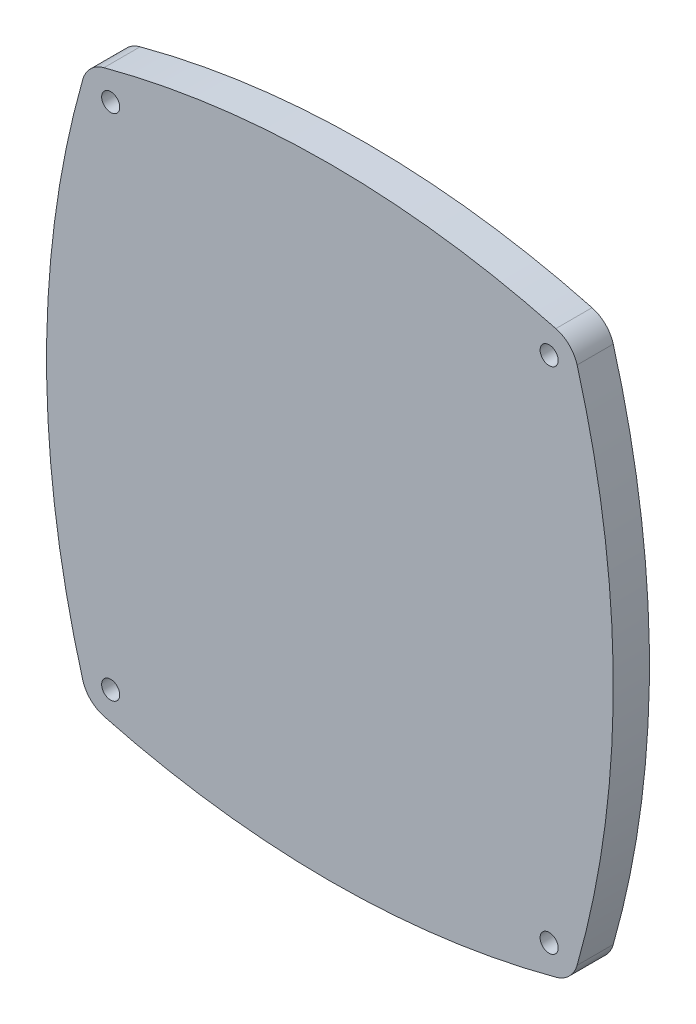
from build123d import *

# Parameters (mm, degrees)
BOSS_EXTRUDE1_DEPTH                                  = 6
CUT_EXTRUDE1_DEPTH                                   = 3
CBORE_FOR_1_4_BINDING_HEAD_MACHINE_SCREW_D           = 3.000000096
CBORE_FOR_1_4_BINDING_HEAD_MACHINE_SCREW_CBORE_D     = 5.999999938
CBORE_FOR_1_4_BINDING_HEAD_MACHINE_SCREW_CBORE_DEPTH = 2.50000008


with BuildPart() as part:
    # Sketch2 → Boss-Extrude1 (new body)
    with BuildSketch(Plane.XY):
        with BuildLine():
            ThreePointArc((-54.248199695, 36.170030774), (-60.248199695, -6.952025582), (-54.248199695, -50.074081938))
            ThreePointArc((-54.248199695, -50.074081938), (-52.94547726, -52.272598149), (-50.726555175, -53.540251118))
            ThreePointArc((-50.726555175, -53.540251118), (-13.248199695, -58.452025582), (24.230155786, -53.540251118))
            ThreePointArc((24.230155786, -53.540251118), (26.449077871, -52.272598149), (27.751800305, -50.074081938))
            ThreePointArc((27.751800305, -50.074081938), (33.751800305, -6.952025582), (27.751800305, 36.170030774))
            ThreePointArc((27.751800305, 36.170030774), (26.449077871, 38.368546985), (24.230155786, 39.636199954))
            ThreePointArc((24.230155786, 39.636199954), (-13.248199695, 44.547974418), (-50.726555175, 39.636199954))
            ThreePointArc((-50.726555175, 39.636199954), (-52.94547726, 38.368546985), (-54.248199695, 36.170030774))
        make_face()
    extrude(amount=BOSS_EXTRUDE1_DEPTH)

    # Sketch3 → Cut-Extrude1 (cut)
    # profile 1 of 3: a face of its own
    with BuildSketch(Plane(origin=(0, 0, 0), x_dir=(-1, 0, 0), z_dir=(0, 0, -1))):
        with BuildLine():
            Line((27.557264502, 1.973116974), (27.705702002, 1.973116974))
            add(Edge.make_bspline(
                [(27.705702002, 1.973116974), (27.939373877, 1.718273224), (28.188905127, 1.401241974), (28.454530127, 1.022570099)],
                knots=[16, 16, 16, 16, 17, 17, 17, 17], degree=3))
            add(Edge.make_bspline(
                [(28.454530127, 1.022570099), (28.719998877, 0.643663849), (28.964373877, 0.234874786), (29.18738169, -0.204148651)],
                knots=[17, 17, 17, 17, 18, 18, 18, 18], degree=3))
            add(Edge.make_bspline(
                [(29.18738169, -0.204148651), (29.410389502, -0.643133026), (29.596170752, -1.090945526), (29.744959815, -1.547664276)],
                knots=[18, 18, 18, 18, 19, 19, 19, 19], degree=3))
            add(Edge.make_bspline(
                [(29.744959815, -1.547664276), (29.893748877, -2.004383026), (29.967967627, -2.438054901), (29.967967627, -2.848718964)],
                knots=[19, 19, 19, 19, 20, 20, 20, 20], degree=3))
            add(Edge.make_bspline(
                [(29.967967627, -2.848718964), (29.967967627, -3.216804901), (29.916795752, -3.526765839), (29.814061377, -3.777976776)],
                knots=[20, 20, 20, 20, 21, 21, 21, 21], degree=3))
            add(Edge.make_bspline(
                [(29.814061377, -3.777976776), (29.71128794, -4.029539276), (29.567967627, -4.232976776), (29.38378794, -4.388836151)],
                knots=[21, 21, 21, 21, 22, 22, 22, 22], degree=3))
            add(Edge.make_bspline(
                [(29.38378794, -4.388836151), (29.199764502, -4.544500214), (28.974842627, -4.656179901), (28.709530127, -4.723367401)],
                knots=[22, 22, 22, 22, 23, 23, 23, 23], degree=3))
            add(Edge.make_bspline(
                [(28.709530127, -4.723367401), (28.688748877, -4.728523651), (28.66691294, -4.732312714), (28.645936377, -4.737117401)],
                knots=[23, 23, 23, 23, 24, 24, 24, 24], degree=3))
            add(Edge.make_bspline(
                [(28.645936377, -4.737117401), (28.855584815, -4.994343964), (29.053202002, -5.260515839), (29.229842627, -5.541101776)],
                knots=[24, 24, 24, 24, 25, 25, 25, 25], degree=3))
            add(Edge.make_bspline(
                [(29.229842627, -5.541101776), (29.44597544, -5.884578339), (29.622811377, -6.261570526), (29.760780127, -6.672234589)],
                knots=[25, 25, 25, 25, 26, 26, 26, 26], degree=3))
            add(Edge.make_bspline(
                [(29.760780127, -6.672234589), (29.898905127, -7.082898651), (29.967967627, -7.546843964), (29.967967627, -8.063523651)],
                knots=[26, 26, 26, 26, 27, 27, 27, 27], degree=3))
            add(Edge.make_bspline(
                [(29.967967627, -8.063523651), (29.967967627, -8.318523651), (29.884842627, -8.532781464), (29.718514502, -8.70616037)],
                knots=[27, 27, 27, 27, 28, 28, 28, 28], degree=3))
            add(Edge.make_bspline(
                [(29.718514502, -8.70616037), (29.552186377, -8.879695526), (29.32019419, -9.019402557), (29.022772315, -9.125593964)],
                knots=[28, 28, 28, 28, 29, 29, 29, 29], degree=3))
            add(Edge.make_bspline(
                [(29.022772315, -9.125593964), (28.725311377, -9.23178537), (28.374803565, -9.308074432), (27.971366065, -9.353953339)],
                knots=[29, 29, 29, 29, 30, 30, 30, 30], degree=3))
            add(Edge.make_bspline(
                [(27.971366065, -9.353953339), (27.567577002, -9.400164276), (27.128709815, -9.423015839), (26.654295752, -9.423015839)],
                knots=[30, 30, 30, 30, 31, 31, 31, 31], degree=3))
            add(Edge.make_bspline(
                [(26.654295752, -9.423015839), (26.208241065, -9.423015839), (25.735545752, -9.407039276), (25.236366065, -9.375261932)],
                knots=[31, 31, 31, 31, 32, 32, 32, 32], degree=3))
            add(Edge.make_bspline(
                [(25.236366065, -9.375261932), (24.73722544, -9.343484589), (24.232733252, -9.299148651), (23.722928565, -9.242429901)],
                knots=[32, 32, 32, 32, 33, 33, 33, 33], degree=3))
            Line((23.722928565, -9.242429901), (23.722928565, -9.401883026))
            Line((23.722928565, -9.401883026), (29.214022315, -11.557820526))
            add(Edge.make_bspline(
                [(29.214022315, -11.557820526), (29.511248877, -11.742000214), (29.71128794, -11.947175995), (29.814061377, -12.17381662)],
                knots=[35, 35, 35, 35, 36, 36, 36, 36], degree=3))
            add(Edge.make_bspline(
                [(29.814061377, -12.17381662), (29.916795752, -12.400457245), (29.967967627, -12.662508026), (29.967967627, -12.95975412)],
                knots=[36, 36, 36, 36, 37, 37, 37, 37], degree=3))
            add(Edge.make_bspline(
                [(29.967967627, -12.95975412), (29.967967627, -13.186394745), (29.90613169, -13.367000214), (29.78206919, -13.501355682)],
                knots=[37, 37, 37, 37, 38, 38, 38, 38], degree=3))
            add(Edge.make_bspline(
                [(29.78206919, -13.501355682), (29.658358252, -13.635906464), (29.498905127, -13.740359589), (29.304217627, -13.814773651)],
                knots=[38, 38, 38, 38, 39, 39, 39, 39], degree=3))
            add(Edge.make_bspline(
                [(29.304217627, -13.814773651), (29.109530127, -13.889168182), (28.895272315, -13.938836151), (28.66175669, -13.963406464)],
                knots=[39, 39, 39, 39, 40, 40, 40, 40], degree=3))
            add(Edge.make_bspline(
                [(28.66175669, -13.963406464), (28.428045752, -13.988328339), (28.201405127, -14.00069162), (27.982030127, -14.00069162)],
                knots=[40, 40, 40, 40, 41, 41, 41, 41], degree=3))
            add(Edge.make_bspline(
                [(27.982030127, -14.00069162), (27.889920752, -14.00069162), (27.758983252, -13.993640839), (27.588866065, -13.979383026)],
                knots=[41, 41, 41, 41, 42, 42, 42, 42], degree=3))
            add(Edge.make_bspline(
                [(27.588866065, -13.979383026), (27.41910044, -13.965125214), (27.22425669, -13.943992401), (27.004647315, -13.915633026)],
                knots=[42, 42, 42, 42, 43, 43, 43, 43], degree=3))
            add(Edge.make_bspline(
                [(27.004647315, -13.915633026), (26.785389502, -13.887449432), (26.553436377, -13.855496307), (26.30910044, -13.820086151)],
                knots=[43, 43, 43, 43, 44, 44, 44, 44], degree=3))
            add(Edge.make_bspline(
                [(26.30910044, -13.820086151), (26.064764502, -13.784539276), (25.822498877, -13.749304901), (25.581561377, -13.713914276)],
                knots=[44, 44, 44, 44, 45, 45, 45, 45], degree=3))
            add(Edge.make_bspline(
                [(25.581561377, -13.713914276), (25.015233252, -13.635906464), (24.40628794, -13.540359589), (23.754686377, -13.427117401)],
                knots=[45, 45, 45, 45, 46, 46, 46, 46], degree=3))
            Line((23.754686377, -13.427117401), (23.754686377, -13.586414276))
            add(Edge.make_bspline(
                [(23.754686377, -13.586414276), (23.860897315, -13.671453339), (24.02035044, -13.768894745), (24.232733252, -13.878523651)],
                knots=[47, 47, 47, 47, 48, 48, 48, 48], degree=3))
            add(Edge.make_bspline(
                [(24.232733252, -13.878523651), (24.445116065, -13.988328339), (24.756795752, -14.142273651), (25.167498877, -14.340554901)],
                knots=[48, 48, 48, 48, 49, 49, 49, 49], degree=3))
            add(Edge.make_bspline(
                [(25.167498877, -14.340554901), (25.578123877, -14.538679901), (26.110780127, -14.79178537), (26.76581919, -15.099871307)],
                knots=[49, 49, 49, 49, 50, 50, 50, 50], degree=3))
            add(Edge.make_bspline(
                [(26.76581919, -15.099871307), (27.42081919, -15.407957245), (28.240467627, -15.806258026), (29.224491065, -16.29475412)],
                knots=[50, 50, 50, 50, 51, 51, 51, 51], degree=3))
            add(Edge.make_bspline(
                [(29.224491065, -16.29475412), (29.51488169, -16.436336151), (29.71128794, -16.601140839), (29.814061377, -16.788601776)],
                knots=[51, 51, 51, 51, 52, 52, 52, 52], degree=3))
            add(Edge.make_bspline(
                [(29.814061377, -16.788601776), (29.916795752, -16.976394745), (29.967967627, -17.183289276), (29.967967627, -17.409929901)],
                knots=[52, 52, 52, 52, 53, 53, 53, 53], degree=3))
            add(Edge.make_bspline(
                [(29.967967627, -17.409929901), (29.967967627, -17.700320526), (29.90613169, -17.933992401), (29.78206919, -18.110808807)],
                knots=[53, 53, 53, 53, 54, 54, 54, 54], degree=3))
            add(Edge.make_bspline(
                [(29.78206919, -18.110808807), (29.658358252, -18.287781464), (29.491873877, -18.424226776), (29.282889502, -18.51975412)],
                knots=[54, 54, 54, 54, 55, 55, 55, 55], degree=3))
            add(Edge.make_bspline(
                [(29.282889502, -18.51975412), (29.074139502, -18.615281464), (28.836873877, -18.679031464), (28.571405127, -18.710984589)],
                knots=[55, 55, 55, 55, 56, 56, 56, 56], degree=3))
            add(Edge.make_bspline(
                [(28.571405127, -18.710984589), (28.305741065, -18.742781464), (28.031483252, -18.758758026), (27.74831919, -18.758758026)],
                knots=[56, 56, 56, 56, 57, 57, 57, 57], degree=3))
            add(Edge.make_bspline(
                [(27.74831919, -18.758758026), (27.457928565, -18.758758026), (27.114608252, -18.741062714), (26.718045752, -18.705672089)],
                knots=[57, 57, 57, 57, 58, 58, 58, 58], degree=3))
            add(Edge.make_bspline(
                [(26.718045752, -18.705672089), (26.321483252, -18.670281464), (25.903905127, -18.624226776), (25.46472544, -18.567508026)],
                knots=[58, 58, 58, 58, 59, 59, 59, 59], degree=3))
            add(Edge.make_bspline(
                [(25.46472544, -18.567508026), (25.025897315, -18.510828339), (24.577928565, -18.445515839), (24.121209815, -18.371121307)],
                knots=[59, 59, 59, 59, 60, 60, 60, 60], degree=3))
            add(Edge.make_bspline(
                [(24.121209815, -18.371121307), (23.664491065, -18.296726776), (23.22738169, -18.219070526), (22.809647315, -18.137429901)],
                knots=[60, 60, 60, 60, 61, 61, 61, 61], degree=3))
            add(Edge.make_bspline(
                [(22.809647315, -18.137429901), (22.39175669, -18.05616037), (22.009452002, -17.972820526), (21.66253794, -17.887781464)],
                knots=[61, 61, 61, 61, 62, 62, 62, 62], degree=3))
            add(Edge.make_bspline(
                [(21.66253794, -17.887781464), (21.315623877, -17.802898651), (21.032264502, -17.724890839), (20.81285044, -17.654265839)],
                knots=[62, 62, 62, 62, 63, 63, 63, 63], degree=3))
            add(Edge.make_bspline(
                [(20.81285044, -17.654265839), (20.586209815, -17.583465057), (20.405780127, -17.516101776), (20.271092627, -17.452351776)],
                knots=[63, 63, 63, 63, 64, 64, 64, 64], degree=3))
            add(Edge.make_bspline(
                [(20.271092627, -17.452351776), (20.136717627, -17.388601776), (20.03222544, -17.316277557), (19.957811377, -17.234656464)],
                knots=[64, 64, 64, 64, 65, 65, 65, 65], degree=3))
            add(Edge.make_bspline(
                [(19.957811377, -17.234656464), (19.883436377, -17.153367401), (19.83394419, -17.055789276), (19.809217627, -16.942547089)],
                knots=[65, 65, 65, 65, 66, 66, 66, 66], degree=3))
            add(Edge.make_bspline(
                [(19.809217627, -16.942547089), (19.784452002, -16.829304901), (19.772108252, -16.684109589), (19.772108252, -16.507136932)],
                knots=[66, 66, 66, 66, 67, 67, 67, 67], degree=3))
            add(Edge.make_bspline(
                [(19.772108252, -16.507136932), (19.772108252, -16.238054901), (19.781014502, -16.02756662), (19.798553565, -15.875164276)],
                knots=[67, 67, 67, 67, 68, 68, 68, 68], degree=3))
            add(Edge.make_bspline(
                [(19.798553565, -15.875164276), (19.816248877, -15.723093964), (19.858670752, -15.609695526), (19.926053565, -15.535281464)],
                knots=[68, 68, 68, 68, 69, 69, 69, 69], degree=3))
            add(Edge.make_bspline(
                [(19.926053565, -15.535281464), (19.993397315, -15.461062714), (20.09066294, -15.416883026), (20.21816294, -15.402625214)],
                knots=[69, 69, 69, 69, 70, 70, 70, 70], degree=3))
            add(Edge.make_bspline(
                [(20.21816294, -15.402625214), (20.345623877, -15.388367401), (20.519022315, -15.381336151), (20.738436377, -15.381336151)],
                knots=[70, 70, 70, 70, 71, 71, 71, 71], degree=3))
            add(Edge.make_bspline(
                [(20.738436377, -15.381336151), (20.858905127, -15.381336151), (20.996873877, -15.386648651), (21.152733252, -15.397312714)],
                knots=[71, 71, 71, 71, 72, 72, 72, 72], degree=3))
            add(Edge.make_bspline(
                [(21.152733252, -15.397312714), (21.308553565, -15.407957245), (21.474920752, -15.423758026), (21.651873877, -15.44506662)],
                knots=[72, 72, 72, 72, 73, 73, 73, 73], degree=3))
            add(Edge.make_bspline(
                [(21.651873877, -15.44506662), (21.828866065, -15.466375214), (22.011327002, -15.489402557), (22.198983252, -15.514148651)],
                knots=[73, 73, 73, 73, 74, 74, 74, 74], degree=3))
            add(Edge.make_bspline(
                [(22.198983252, -15.514148651), (22.38660044, -15.538875214), (22.568748877, -15.565515839), (22.745741065, -15.593699432)],
                knots=[74, 74, 74, 74, 75, 75, 75, 75], degree=3))
            add(Edge.make_bspline(
                [(22.745741065, -15.593699432), (23.16363169, -15.657449432), (23.595584815, -15.724812714), (24.041639502, -15.795593964)],
                knots=[75, 75, 75, 75, 76, 76, 76, 76], degree=3))
            Line((24.041639502, -15.795593964), (24.168983252, -15.678758026))
            add(Edge.make_bspline(
                [(24.168983252, -15.678758026), (24.14785044, -15.664500214), (24.01331919, -15.588367401), (23.76535044, -15.450398651)],
                knots=[77, 77, 77, 77, 78, 78, 78, 78], degree=3))
            add(Edge.make_bspline(
                [(23.76535044, -15.450398651), (23.517577002, -15.312234589), (23.220311377, -15.142312714), (22.873241065, -14.940593964)],
                knots=[78, 78, 78, 78, 79, 79, 79, 79], degree=3))
            add(Edge.make_bspline(
                [(22.873241065, -14.940593964), (22.526483252, -14.738855682), (22.163592627, -14.520984589), (21.784530127, -14.287293182)],
                knots=[79, 79, 79, 79, 80, 80, 80, 80], degree=3))
            add(Edge.make_bspline(
                [(21.784530127, -14.287293182), (21.40581919, -14.053777557), (21.07144419, -13.830750214), (20.781053565, -13.618211151)],
                knots=[80, 80, 80, 80, 81, 81, 81, 81], degree=3))
            add(Edge.make_bspline(
                [(20.781053565, -13.618211151), (20.49066294, -13.412859589), (20.249920752, -13.195320526), (20.058670752, -12.965086151)],
                knots=[81, 81, 81, 81, 82, 82, 82, 82], degree=3))
            add(Edge.make_bspline(
                [(20.058670752, -12.965086151), (19.867616065, -12.735008026), (19.772108252, -12.460593964), (19.772108252, -12.142039276)],
                knots=[82, 82, 82, 82, 83, 83, 83, 83], degree=3))
            add(Edge.make_bspline(
                [(19.772108252, -12.142039276), (19.772108252, -11.84459787), (19.858670752, -11.58959787), (20.03222544, -11.377234589)],
                knots=[83, 83, 83, 83, 84, 84, 84, 84], degree=3))
            add(Edge.make_bspline(
                [(20.03222544, -11.377234589), (20.205780127, -11.164851776), (20.451834815, -11.058640839), (20.770389502, -11.058640839)],
                knots=[84, 84, 84, 84, 85, 85, 85, 85], degree=3))
            add(Edge.make_bspline(
                [(20.770389502, -11.058640839), (21.046366065, -11.058640839), (21.308553565, -11.076355682), (21.556327002, -11.111746307)],
                knots=[85, 85, 85, 85, 86, 86, 86, 86], degree=3))
            add(Edge.make_bspline(
                [(21.556327002, -11.111746307), (21.804139502, -11.147312714), (22.044842627, -11.19147287), (22.278514502, -11.244578339)],
                knots=[86, 86, 86, 86, 87, 87, 87, 87], degree=3))
            add(Edge.make_bspline(
                [(22.278514502, -11.244578339), (22.512030127, -11.297664276), (22.740584815, -11.352468964), (22.963592627, -11.409187714)],
                knots=[87, 87, 87, 87, 88, 88, 88, 88], degree=3))
            add(Edge.make_bspline(
                [(22.963592627, -11.409187714), (23.186639502, -11.465886932), (23.414842627, -11.518992401), (23.648514502, -11.568465057)],
                knots=[88, 88, 88, 88, 89, 89, 89, 89], degree=3))
            add(Edge.make_bspline(
                [(23.648514502, -11.568465057), (23.811405127, -11.603875214), (23.914139502, -11.625164276), (23.95660044, -11.632215057)],
                knots=[89, 89, 89, 89, 90, 90, 90, 90], degree=3))
            add(Edge.make_bspline(
                [(23.95660044, -11.632215057), (23.999061377, -11.639265839), (24.027577002, -11.642859589), (24.041639502, -11.642859589)],
                knots=[90, 90, 90, 90, 91, 91, 91, 91], degree=3))
            Line((24.041639502, -11.642859589), (24.168983252, -11.526023651))
            add(Edge.make_bspline(
                [(24.168983252, -11.526023651), (24.14785044, -11.511765839), (24.01503794, -11.430320526), (23.770858252, -11.281687714)],
                knots=[92, 92, 92, 92, 93, 93, 93, 93], degree=3))
            add(Edge.make_bspline(
                [(23.770858252, -11.281687714), (23.526522315, -11.133054901), (23.23097544, -10.950750214), (22.883905127, -10.734773651)],
                knots=[93, 93, 93, 93, 94, 94, 94, 94], degree=3))
            add(Edge.make_bspline(
                [(22.883905127, -10.734773651), (22.537147315, -10.518953339), (22.172186377, -10.288699432), (21.79003794, -10.044343964)],
                knots=[94, 94, 94, 94, 95, 95, 95, 95], degree=3))
            add(Edge.make_bspline(
                [(21.79003794, -10.044343964), (21.40753794, -9.800008026), (21.07144419, -9.571648651), (20.781053565, -9.359265839)],
                knots=[95, 95, 95, 95, 96, 96, 96, 96], degree=3))
            add(Edge.make_bspline(
                [(20.781053565, -9.359265839), (20.497889502, -9.153953339), (20.258866065, -8.948797089), (20.064178565, -8.743289276)],
                knots=[96, 96, 96, 96, 97, 97, 97, 97], degree=3))
            add(Edge.make_bspline(
                [(20.064178565, -8.743289276), (19.869334815, -8.537937714), (19.772108252, -8.286570526), (19.772108252, -7.989304901)],
                knots=[97, 97, 97, 97, 98, 98, 98, 98], degree=3))
            add(Edge.make_bspline(
                [(19.772108252, -7.989304901), (19.772108252, -7.656453339), (19.858670752, -7.375183807), (20.03222544, -7.144929901)],
                knots=[98, 98, 98, 98, 99, 99, 99, 99], degree=3))
            add(Edge.make_bspline(
                [(20.03222544, -7.144929901), (20.205780127, -6.914851776), (20.451834815, -6.799734589), (20.770389502, -6.799734589)],
                knots=[99, 99, 99, 99, 100, 100, 100, 100], degree=3))
            add(Edge.make_bspline(
                [(20.770389502, -6.799734589), (21.258905127, -6.799734589), (21.722655127, -6.824480682), (22.161678565, -6.873953339)],
                knots=[100, 100, 100, 100, 101, 101, 101, 101], degree=3))
            add(Edge.make_bspline(
                [(22.161678565, -6.873953339), (22.600702002, -6.923445526), (23.03269419, -6.980320526), (23.457420752, -7.044070526)],
                knots=[101, 101, 101, 101, 102, 102, 102, 102], degree=3))
            add(Edge.make_bspline(
                [(23.457420752, -7.044070526), (23.882186377, -7.107664276), (24.312459815, -7.164343964), (24.747889502, -7.213836151)],
                knots=[102, 102, 102, 102, 103, 103, 103, 103], degree=3))
            add(Edge.make_bspline(
                [(24.747889502, -7.213836151), (25.183280127, -7.263328339), (25.645311377, -7.288250214), (26.133827002, -7.288250214)],
                knots=[103, 103, 103, 103, 104, 104, 104, 104], degree=3))
            add(Edge.make_bspline(
                [(26.133827002, -7.288250214), (26.516327002, -7.288250214), (26.82785044, -7.238758026), (27.068592627, -7.139617401)],
                knots=[104, 104, 104, 104, 105, 105, 105, 105], degree=3))
            add(Edge.make_bspline(
                [(27.068592627, -7.139617401), (27.309295752, -7.040281464), (27.429608252, -6.920183807), (27.429608252, -6.778425995)],
                knots=[105, 105, 105, 105, 106, 106, 106, 106], degree=3))
            add(Edge.make_bspline(
                [(27.429608252, -6.778425995), (27.429608252, -6.629793182), (27.397811377, -6.474109589), (27.334061377, -6.311062714)],
                knots=[106, 106, 106, 106, 107, 107, 107, 107], degree=3))
            add(Edge.make_bspline(
                [(27.334061377, -6.311062714), (27.270311377, -6.148172089), (27.188827002, -5.981843964), (27.089686377, -5.811883026)],
                knots=[107, 107, 107, 107, 108, 108, 108, 108], degree=3))
            add(Edge.make_bspline(
                [(27.089686377, -5.811883026), (26.990545752, -5.641961151), (26.875623877, -5.475633026), (26.744530127, -5.312742401)],
                knots=[108, 108, 108, 108, 109, 109, 109, 109], degree=3))
            add(Edge.make_bspline(
                [(26.744530127, -5.312742401), (26.613592627, -5.149851776), (26.477342627, -4.994148651), (26.335545752, -4.845554901)],
                knots=[109, 109, 109, 109, 110, 110, 110, 110], degree=3))
            add(Edge.make_bspline(
                [(26.335545752, -4.845554901), (26.272498877, -4.778367401), (26.206327002, -4.711336151), (26.139998877, -4.644304901)],
                knots=[110, 110, 110, 110, 111, 111, 111, 111], degree=3))
            add(Edge.make_bspline(
                [(26.139998877, -4.644304901), (25.590858252, -4.546218964), (25.025545752, -4.430554901), (24.439959815, -4.293133026)],
                knots=[111, 111, 111, 111, 112, 112, 112, 112], degree=3))
            add(Edge.make_bspline(
                [(24.439959815, -4.293133026), (23.806248877, -4.144461151), (23.174295752, -3.987078339), (22.544022315, -3.820593964)],
                knots=[112, 112, 112, 112, 113, 113, 113, 113], degree=3))
            add(Edge.make_bspline(
                [(22.544022315, -3.820593964), (21.913905127, -3.654265839), (21.33331919, -3.507195526), (20.802186377, -3.379851776)],
                knots=[113, 113, 113, 113, 114, 114, 114, 114], degree=3))
            add(Edge.make_bspline(
                [(20.802186377, -3.379851776), (20.61816294, -3.330359589), (20.460780127, -3.231023651), (20.329491065, -3.082429901)],
                knots=[114, 114, 114, 114, 115, 115, 115, 115], degree=3))
            add(Edge.make_bspline(
                [(20.329491065, -3.082429901), (20.198553565, -2.933797089), (20.09238169, -2.765750214), (20.010936377, -2.577937714)],
                knots=[115, 115, 115, 115, 116, 116, 116, 116], degree=3))
            add(Edge.make_bspline(
                [(20.010936377, -2.577937714), (19.929491065, -2.390281464), (19.869334815, -2.195633026), (19.83050669, -1.993718964)],
                knots=[116, 116, 116, 116, 117, 117, 117, 117], degree=3))
            add(Edge.make_bspline(
                [(19.83050669, -1.993718964), (19.791483252, -1.792000214), (19.772108252, -1.609695526), (19.772108252, -1.446804901)],
                knots=[117, 117, 117, 117, 118, 118, 118, 118], degree=3))
            add(Edge.make_bspline(
                [(19.772108252, -1.446804901), (19.772108252, -1.149343964), (19.826873877, -0.947625214), (19.936717627, -0.841453339)],
                knots=[118, 118, 118, 118, 119, 119, 119, 119], degree=3))
            add(Edge.make_bspline(
                [(19.936717627, -0.841453339), (20.046327002, -0.735242401), (20.193397315, -0.682156464), (20.377264502, -0.682156464)],
                knots=[119, 119, 119, 119, 120, 120, 120, 120], degree=3))
            add(Edge.make_bspline(
                [(20.377264502, -0.682156464), (20.533280127, -0.682156464), (20.758045752, -0.717547089), (21.051873877, -0.788367401)],
                knots=[120, 120, 120, 120, 121, 121, 121, 121], degree=3))
            add(Edge.make_bspline(
                [(21.051873877, -0.788367401), (21.345702002, -0.858953339), (21.678358252, -0.947625214), (22.050155127, -1.053836151)],
                knots=[121, 121, 121, 121, 122, 122, 122, 122], degree=3))
            add(Edge.make_bspline(
                [(22.050155127, -1.053836151), (22.422030127, -1.160008026), (22.822030127, -1.273250214), (23.250233252, -1.393679901)],
                knots=[122, 122, 122, 122, 123, 123, 123, 123], degree=3))
            add(Edge.make_bspline(
                [(23.250233252, -1.393679901), (23.678748877, -1.514148651), (24.107108252, -1.627390839), (24.535467627, -1.733562714)],
                knots=[123, 123, 123, 123, 124, 124, 124, 124], degree=3))
            add(Edge.make_bspline(
                [(24.535467627, -1.733562714), (24.963866065, -1.839773651), (25.381561377, -1.928445526), (25.788827002, -1.999031464)],
                knots=[124, 124, 124, 124, 125, 125, 125, 125], degree=3))
            add(Edge.make_bspline(
                [(25.788827002, -1.999031464), (26.195858252, -2.069851776), (26.562342627, -2.105242401), (26.887967627, -2.105242401)],
                knots=[125, 125, 125, 125, 126, 126, 126, 126], degree=3))
            add(Edge.make_bspline(
                [(26.887967627, -2.105242401), (27.206561377, -2.105242401), (27.459647315, -2.069851776), (27.647264502, -1.999031464)],
                knots=[126, 126, 126, 126, 127, 127, 127, 127], degree=3))
            add(Edge.make_bspline(
                [(27.647264502, -1.999031464), (27.834920752, -1.928445526), (27.928748877, -1.783054901), (27.928748877, -1.563640839)],
                knots=[127, 127, 127, 127, 128, 128, 128, 128], degree=3))
            add(Edge.make_bspline(
                [(27.928748877, -1.563640839), (27.928748877, -1.308797089), (27.840428565, -1.025633026), (27.663280127, -0.713953339)],
                knots=[128, 128, 128, 128, 129, 129, 129, 129], degree=3))
            add(Edge.make_bspline(
                [(27.663280127, -0.713953339), (27.486483252, -0.402234589), (27.272030127, -0.087273651), (27.020780127, 0.231281036)],
                knots=[129, 129, 129, 129, 130, 130, 130, 130], degree=3))
            add(Edge.make_bspline(
                [(27.020780127, 0.231281036), (26.76941294, 0.549835724), (26.50910044, 0.861554474), (26.239998877, 1.165851349)],
                knots=[130, 130, 130, 130, 131, 131, 131, 131], degree=3))
            add(Edge.make_bspline(
                [(26.239998877, 1.165851349), (26.11441294, 1.308116974), (25.998084815, 1.441788849), (25.889491065, 1.568624786)],
                knots=[131, 131, 131, 131, 132, 132, 132, 132], degree=3))
            add(Edge.make_bspline(
                [(25.889491065, 1.568624786), (25.217303565, 1.459171661), (24.517616065, 1.401085724), (23.786678565, 1.401085724)],
                knots=[132, 132, 132, 132, 133, 133, 133, 133], degree=3))
            add(Edge.make_bspline(
                [(23.786678565, 1.401085724), (23.156405127, 1.401085724), (22.471483252, 1.447140411), (21.73160044, 1.539054474)],
                knots=[133, 133, 133, 133, 134, 134, 134, 134], degree=3))
            add(Edge.make_bspline(
                [(21.73160044, 1.539054474), (20.991717627, 1.631320099), (20.228827002, 1.765851349), (19.44285044, 1.942687286)],
                knots=[134, 134, 134, 134, 135, 135, 135, 135], degree=3))
            add(Edge.make_bspline(
                [(19.44285044, 1.942687286), (18.65691294, 2.119835724), (17.86738169, 2.330656036), (17.074373877, 2.574835724)],
                knots=[135, 135, 135, 135, 136, 136, 136, 136], degree=3))
            add(Edge.make_bspline(
                [(17.074373877, 2.574835724), (16.281248877, 2.819171661), (15.52003794, 3.095304474), (14.790780127, 3.403390411)],
                knots=[136, 136, 136, 136, 137, 137, 137, 137], degree=3))
            add(Edge.make_bspline(
                [(14.790780127, 3.403390411), (14.061561377, 3.711320099), (13.379998877, 4.045695099), (12.746307471, 4.406866974)],
                knots=[137, 137, 137, 137, 138, 138, 138, 138], degree=3))
            add(Edge.make_bspline(
                [(12.746307471, 4.406866974), (12.11269419, 4.767882599), (11.56035044, 5.146749786), (11.089452002, 5.543156036)],
                knots=[138, 138, 138, 138, 139, 139, 139, 139], degree=3))
            add(Edge.make_bspline(
                [(11.089452002, 5.543156036), (10.618651221, 5.939757599), (10.248709815, 6.354015411), (9.979530127, 6.785812286)],
                knots=[139, 139, 139, 139, 140, 140, 140, 140], degree=3))
            add(Edge.make_bspline(
                [(9.979530127, 6.785812286), (9.710545752, 7.217960724), (9.576014502, 7.656788849), (9.576014502, 8.102882599)],
                knots=[140, 140, 140, 140, 141, 141, 141, 141], degree=3))
            add(Edge.make_bspline(
                [(9.576014502, 8.102882599), (9.576014502, 8.407335724), (9.644998877, 8.658741974), (9.783045752, 8.856866974)],
                knots=[141, 141, 141, 141, 142, 142, 142, 142], degree=3))
            add(Edge.make_bspline(
                [(9.783045752, 8.856866974), (9.92113169, 9.055304474), (10.103514502, 9.211007599), (10.330077002, 9.324210724)],
                knots=[142, 142, 142, 142, 143, 143, 143, 143], degree=3))
            add(Edge.make_bspline(
                [(10.330077002, 9.324210724), (10.556717627, 9.437648224), (10.813338721, 9.517023224), (11.100116065, 9.563429474)],
                knots=[143, 143, 143, 143, 144, 144, 144, 144], degree=3))
            add(Edge.make_bspline(
                [(11.100116065, 9.563429474), (11.386815284, 9.609288849), (11.678905127, 9.632140411), (11.976268409, 9.632140411)],
                knots=[144, 144, 144, 144, 145, 145, 145, 145], degree=3))
            add(Edge.make_bspline(
                [(11.976268409, 9.632140411), (12.64191294, 9.632140411), (13.31988169, 9.556202911), (14.01019419, 9.404132599)],
                knots=[145, 145, 145, 145, 146, 146, 146, 146], degree=3))
            add(Edge.make_bspline(
                [(14.01019419, 9.404132599), (14.700428565, 9.251554474), (15.394608252, 9.046398224), (16.091873877, 8.788116974)],
                knots=[146, 146, 146, 146, 147, 147, 147, 147], degree=3))
            add(Edge.make_bspline(
                [(16.091873877, 8.788116974), (16.789334815, 8.529366974), (17.488514502, 8.230187286), (18.189530127, 7.890499786)],
                knots=[147, 147, 147, 147, 148, 148, 148, 148], degree=3))
            add(Edge.make_bspline(
                [(18.189530127, 7.890499786), (18.890428565, 7.550616974), (19.586170752, 7.196632599), (20.276561377, 6.828273224)],
                knots=[148, 148, 148, 148, 149, 149, 149, 149], degree=3))
            add(Edge.make_bspline(
                [(20.276561377, 6.828273224), (20.966795752, 6.460226349), (21.646561377, 6.090421661), (22.31566294, 5.718585724)],
                knots=[149, 149, 149, 149, 150, 150, 150, 150], degree=3))
            add(Edge.make_bspline(
                [(22.31566294, 5.718585724), (22.984920752, 5.346945099), (23.63785044, 4.998116974), (24.27535044, 4.672335724)],
                knots=[150, 150, 150, 150, 151, 151, 151, 151], degree=3))
            add(Edge.make_bspline(
                [(24.27535044, 4.672335724), (24.34613169, 4.637101349), (24.438241065, 4.599640411), (24.55128794, 4.561007599)],
                knots=[151, 151, 151, 151, 152, 152, 152, 152], degree=3))
            add(Edge.make_bspline(
                [(24.55128794, 4.561007599), (24.664686377, 4.521984161), (24.786717627, 4.484679474), (24.917811377, 4.449288849)],
                knots=[152, 152, 152, 152, 153, 153, 153, 153], degree=3))
            add(Edge.make_bspline(
                [(24.917811377, 4.449288849), (25.048905127, 4.414093536), (25.188592627, 4.378507599), (25.337264502, 4.343116974)],
                knots=[153, 153, 153, 153, 154, 154, 154, 154], degree=3))
            add(Edge.make_bspline(
                [(25.337264502, 4.343116974), (25.486014502, 4.307726349), (25.631092627, 4.279366974), (25.772655127, 4.258038849)],
                knots=[154, 154, 154, 154, 155, 155, 155, 155], degree=3))
            Line((25.772655127, 4.258038849), (25.92144419, 4.258038849))
            add(Edge.make_bspline(
                [(25.92144419, 4.258038849), (26.105623877, 4.258038849), (26.284373877, 4.277648224), (26.457889502, 4.316632599)],
                knots=[156, 156, 156, 156, 157, 157, 157, 157], degree=3))
            add(Edge.make_bspline(
                [(26.457889502, 4.316632599), (26.63144419, 4.355304474), (26.787108252, 4.403429474), (26.925077002, 4.459796661)],
                knots=[157, 157, 157, 157, 158, 158, 158, 158], degree=3))
            add(Edge.make_bspline(
                [(26.925077002, 4.459796661), (27.063084815, 4.516671661), (27.173045752, 4.576632599), (27.254491065, 4.640382599)],
                knots=[158, 158, 158, 158, 159, 159, 159, 159], degree=3))
            add(Edge.make_bspline(
                [(27.254491065, 4.640382599), (27.335936377, 4.704132599), (27.376483252, 4.764445099), (27.376483252, 4.820968536)],
                knots=[159, 159, 159, 159, 160, 160, 160, 160], degree=3))
            add(Edge.make_bspline(
                [(27.376483252, 4.820968536), (27.376483252, 4.955695099), (27.348280127, 5.109445099), (27.29160044, 5.283195099)],
                knots=[160, 160, 160, 160, 161, 161, 161, 161], degree=3))
            add(Edge.make_bspline(
                [(27.29160044, 5.283195099), (27.234920752, 5.456554474), (27.15878794, 5.640421661), (27.063084815, 5.835460724)],
                knots=[161, 161, 161, 161, 162, 162, 162, 162], degree=3))
            add(Edge.make_bspline(
                [(27.063084815, 5.835460724), (26.96753794, 6.030109161), (26.857889502, 6.230148224), (26.733827002, 6.435304474)],
                knots=[162, 162, 162, 162, 163, 163, 163, 163], degree=3))
            add(Edge.make_bspline(
                [(26.733827002, 6.435304474), (26.610155127, 6.640773224), (26.484373877, 6.838898224), (26.356873877, 7.030148224)],
                knots=[163, 163, 163, 163, 164, 164, 164, 164], degree=3))
            add(Edge.make_bspline(
                [(26.356873877, 7.030148224), (26.248123877, 7.193390411), (26.130936377, 7.360577911), (26.009764502, 7.529484161)],
                knots=[164, 164, 164, 164, 165, 165, 165, 165], degree=3))
            add(Edge.make_bspline(
                [(26.009764502, 7.529484161), (25.783123877, 7.507999786), (25.555623877, 7.494445099), (25.326561377, 7.494445099)],
                knots=[165, 165, 165, 165, 166, 166, 166, 166], degree=3))
            add(Edge.make_bspline(
                [(25.326561377, 7.494445099), (24.54785044, 7.494445099), (23.82035044, 7.611281036), (23.144022315, 7.844952911)],
                knots=[166, 166, 166, 166, 167, 167, 167, 167], degree=3))
            add(Edge.make_bspline(
                [(23.144022315, 7.844952911), (22.468045752, 8.078663849), (21.880233252, 8.413351349), (21.381092627, 8.848781036)],
                knots=[167, 167, 167, 167, 168, 168, 168, 168], degree=3))
            add(Edge.make_bspline(
                [(21.381092627, 8.848781036), (20.88175669, 9.284366974), (20.48894419, 9.817023224), (20.202186377, 10.447101349)],
                knots=[168, 168, 168, 168, 169, 169, 169, 169], degree=3))
            add(Edge.make_bspline(
                [(20.202186377, 10.447101349), (20.01847544, 10.850929474), (19.89425669, 11.287023224), (19.828280127, 11.754718536)],
                knots=[169, 169, 169, 169, 170, 170, 170, 170], degree=3))
            add(Edge.make_bspline(
                [(19.828280127, 11.754718536), (20.041873877, 12.978820099), (20.852889502, 14.036241974), (22.00035044, 14.704484161)],
                knots=[170, 170, 170, 170, 171, 171, 171, 171], degree=3))
            Line((22.00035044, 14.704484161), (22.013045752, 14.695382599))
            add(Edge.make_bspline(
                [(22.013045752, 14.695382599), (22.14160044, 14.759835724), (22.273553565, 14.817218536), (22.406561377, 14.871515411)],
                knots=[172, 172, 172, 172, 173, 173, 173, 173], degree=3))
            add(Edge.make_bspline(
                [(22.406561377, 14.871515411), (18.433905127, 14.871515411), (14.164998877, 14.871515411), (13.705389502, 14.871515411)],
                knots=[173, 173, 173, 173, 174, 174, 174, 174], degree=3))
            add(Edge.make_bspline(
                [(13.705389502, 14.871515411), (12.82535044, 14.871515411), (11.509998877, 14.284913849), (10.519842627, 13.294640411)],
                knots=[174, 174, 174, 174, 175, 175, 175, 175], degree=3))
            add(Edge.make_bspline(
                [(10.519842627, 13.294640411), (9.529686377, 12.304406036), (-4.032481591, -2.643054901), (-5.163633935, -4.148445526)],
                knots=[175, 175, 175, 175, 176, 176, 176, 176], degree=3))
            add(Edge.make_bspline(
                [(-5.163633935, -4.148445526), (-6.294766748, -5.653836151), (-6.261251123, -7.056277557), (-5.163633935, -8.759773651)],
                knots=[176, 176, 176, 176, 177, 177, 177, 177], degree=3))
            add(Edge.make_bspline(
                [(-5.163633935, -8.759773651), (-4.065997216, -10.463269745), (9.387420752, -25.168797089), (10.519842627, -26.203015839)],
                knots=[177, 177, 177, 177, 178, 178, 178, 178], degree=3))
            add(Edge.make_bspline(
                [(10.519842627, -26.203015839), (11.652284034, -27.23725412), (13.02878794, -27.706687714), (13.705389502, -27.706687714)],
                knots=[178, 178, 178, 178, 179, 179, 179, 179], degree=3))
            Line((13.705389502, -27.706687714), (29.423670752, -27.706687714))
            add(Edge.make_bspline(
                [(29.423670752, -27.706687714), (31.124217627, -27.706687714), (31.776327002, -26.624519745), (32.062889502, -25.067429901)],
                knots=[180, 180, 180, 180, 181, 181, 181, 181], degree=3))
            add(Edge.make_bspline(
                [(32.062889502, -25.067429901), (32.883905127, -20.609695526), (32.590780127, -17.207859589), (32.590780127, -7.64787912)],
                knots=[181, 181, 181, 181, 182, 182, 182, 182], degree=3))
            add(Edge.make_bspline(
                [(32.590780127, -7.64787912), (32.590780127, 1.912101349), (32.766405127, 7.425187286), (32.062889502, 12.232257599)],
                knots=[182, 182, 182, 182, 183, 183, 183, 183], degree=3))
            add(Edge.make_bspline(
                [(32.062889502, 12.232257599), (31.816522315, 13.917531036), (30.830936377, 14.871515411), (29.423670752, 14.871515411)],
                knots=[183, 183, 183, 183, 184, 184, 184, 184], degree=3))
            add(Edge.make_bspline(
                [(29.423670752, 14.871515411), (28.404530127, 14.871515411), (26.885741065, 14.871515411)],
                knots=[184, 184, 184, 185, 185, 185], degree=2))
            add(Edge.make_bspline(
                [(26.885741065, 14.871515411), (26.964764502, 14.840577911), (27.043670752, 14.809288849), (27.121483252, 14.775304474)],
                knots=[185, 185, 185, 185, 186, 186, 186, 186], degree=3))
            add(Edge.make_bspline(
                [(27.121483252, 14.775304474), (27.518045752, 14.601554474), (27.889920752, 14.389015411), (28.236834815, 14.137960724)],
                knots=[0, 0, 0, 0, 1, 1, 1, 1], degree=3))
            add(Edge.make_bspline(
                [(28.236834815, 14.137960724), (28.583748877, 13.886593536), (28.884764502, 13.599835724), (29.139452002, 13.277648224)],
                knots=[1, 1, 1, 1, 2, 2, 2, 2], degree=3))
            add(Edge.make_bspline(
                [(29.139452002, 13.277648224), (29.394452002, 12.955304474), (29.596170752, 12.603038849), (29.744959815, 12.220734161)],
                knots=[2, 2, 2, 2, 3, 3, 3, 3], degree=3))
            add(Edge.make_bspline(
                [(29.744959815, 12.220734161), (29.893748877, 11.838429474), (29.967967627, 11.431359161), (29.967967627, 10.999366974)],
                knots=[3, 3, 3, 3, 4, 4, 4, 4], degree=3))
            add(Edge.make_bspline(
                [(29.967967627, 10.999366974), (29.967967627, 10.376320099), (29.831717627, 9.843312286), (29.559061377, 9.401202911)],
                knots=[4, 4, 4, 4, 5, 5, 5, 5], degree=3))
            add(Edge.make_bspline(
                [(29.559061377, 9.401202911), (29.286522315, 8.958429474), (28.930858252, 8.595695099), (28.491639502, 8.312335724)],
                knots=[5, 5, 5, 5, 6, 6, 6, 6], degree=3))
            add(Edge.make_bspline(
                [(28.491639502, 8.312335724), (28.430311377, 8.272648224), (28.36519419, 8.238116974), (28.30144419, 8.201515411)],
                knots=[6, 6, 6, 6, 7, 7, 7, 7], degree=3))
            add(Edge.make_bspline(
                [(28.30144419, 8.201515411), (28.464686377, 7.944445099), (28.621561377, 7.688429474), (28.767967627, 7.433781036)],
                knots=[7, 7, 7, 7, 8, 8, 8, 8], degree=3))
            add(Edge.make_bspline(
                [(28.767967627, 7.433781036), (28.916405127, 7.164679474), (29.063514502, 6.887023224), (29.208514502, 6.600226349)],
                knots=[8, 8, 8, 8, 9, 9, 9, 9], degree=3))
            add(Edge.make_bspline(
                [(29.208514502, 6.600226349), (29.353905127, 6.313468536), (29.483123877, 6.024796661), (29.596170752, 5.734406036)],
                knots=[9, 9, 9, 9, 10, 10, 10, 10], degree=3))
            add(Edge.make_bspline(
                [(29.596170752, 5.734406036), (29.70956919, 5.444210724), (29.799920752, 5.160851349), (29.867108252, 4.884718536)],
                knots=[10, 10, 10, 10, 11, 11, 11, 11], degree=3))
            add(Edge.make_bspline(
                [(29.867108252, 4.884718536), (29.934295752, 4.608585724), (29.967967627, 4.350343536), (29.967967627, 4.109445099)],
                knots=[11, 11, 11, 11, 12, 12, 12, 12], degree=3))
            add(Edge.make_bspline(
                [(29.967967627, 4.109445099), (29.967967627, 3.727101349), (29.799920752, 3.371437286), (29.463514502, 3.042218536)],
                knots=[12, 12, 12, 12, 13, 13, 13, 13], degree=3))
            add(Edge.make_bspline(
                [(29.463514502, 3.042218536), (29.127264502, 2.712999786), (28.675858252, 2.426202911), (28.109334815, 2.181866974)],
                knots=[13, 13, 13, 13, 14, 14, 14, 14], degree=3))
            add(Edge.make_bspline(
                [(28.109334815, 2.181866974), (27.934920752, 2.106593536), (27.748827002, 2.038195099), (27.557264502, 1.973116974)],
                knots=[14, 14, 14, 14, 15, 15, 15, 15], degree=3))
        make_face()
        with BuildLine():
            add(Edge.make_bspline(
                [(17.961014502, -2.328250214), (17.66738169, -2.625711151), (17.276092627, -2.774304901), (16.787420752, -2.774304901), (16.62472544, -2.774304901), (16.440702002, -2.738914276), (16.23519419, -2.668133026)],
                knots=[12, 12, 12, 12, 13, 13, 13, 14, 14, 14, 14], degree=3))
            add(Edge.make_bspline(
                [(16.23519419, -2.668133026), (16.029998877, -2.597508026), (15.836873877, -2.482390839), (15.656483252, -2.322937714)],
                knots=[0, 0, 0, 0, 1, 1, 1, 1], degree=3))
            add(Edge.make_bspline(
                [(15.656483252, -2.322937714), (15.475858252, -2.163640839), (15.32363169, -1.951258026), (15.199764502, -1.685789276)],
                knots=[1, 1, 1, 1, 2, 2, 2, 2], degree=3))
            add(Edge.make_bspline(
                [(15.199764502, -1.685789276), (15.075858252, -1.420164276), (15.013827002, -1.089226776), (15.013827002, -0.692625214), (15.013827002, -0.444851776), (15.042186377, -0.211179901), (15.098709815, 0.008234161)],
                knots=[2, 2, 2, 2, 3, 3, 3, 4, 4, 4, 4], degree=3))
            add(Edge.make_bspline(
                [(15.098709815, 0.008234161), (15.155428565, 0.227648224), (15.242186377, 0.418898224), (15.359022315, 0.581788849), (15.475858252, 0.744679474), (15.629842627, 0.873898224), (15.821092627, 0.969445099)],
                knots=[4, 4, 4, 4, 5, 5, 5, 6, 6, 6, 6], degree=3))
            add(Edge.make_bspline(
                [(15.821092627, 0.969445099), (16.012147315, 1.064991974), (16.238983252, 1.112765411), (16.50081919, 1.112765411), (16.741561377, 1.112765411), (16.975077002, 1.073937286), (17.201717627, 0.996085724)],
                knots=[6, 6, 6, 6, 7, 7, 7, 8, 8, 8, 8], degree=3))
            add(Edge.make_bspline(
                [(17.201717627, 0.996085724), (17.428358252, 0.918077911), (17.630077002, 0.794210724), (17.80706919, 0.624249786)],
                knots=[8, 8, 8, 8, 9, 9, 9, 9], degree=3))
            add(Edge.make_bspline(
                [(17.80706919, 0.624249786), (17.984217627, 0.454288849), (18.12769419, 0.240031036), (18.237342627, -0.018367401)],
                knots=[9, 9, 9, 9, 10, 10, 10, 10], degree=3))
            add(Edge.make_bspline(
                [(18.237342627, -0.018367401), (18.347108252, -0.276804901), (18.401952002, -0.586453339), (18.401952002, -0.947625214), (18.401952002, -1.570672089), (18.254998877, -2.031023651), (17.961014502, -2.328250214)],
                knots=[10, 10, 10, 10, 11, 11, 11, 12, 12, 12, 12], degree=3))
        make_face(mode=Mode.SUBTRACT)
    # profile 2 of 3: a face of its own
    with BuildSketch(Plane(origin=(0, 0, 0), x_dir=(-1, 0, 0), z_dir=(0, 0, -1))):
        with BuildLine():
            add(Edge.make_bspline(
                [(22.480428565, 12.974874786), (22.274920752, 12.875890411), (22.112186377, 12.748429474), (21.99175669, 12.592374786)],
                knots=[15, 15, 15, 15, 16, 16, 16, 16], degree=3))
            add(Edge.make_bspline(
                [(21.99175669, 12.592374786), (21.871483252, 12.436710724), (21.811170752, 12.249249786), (21.811170752, 12.029484161), (21.811170752, 11.739445099), (21.93503794, 11.463312286), (22.182811377, 11.201085724)],
                knots=[0, 0, 0, 0, 1, 1, 1, 2, 2, 2, 2], degree=3))
            add(Edge.make_bspline(
                [(22.182811377, 11.201085724), (22.430780127, 10.939210724), (22.747616065, 10.709171661), (23.133358252, 10.510851349)],
                knots=[2, 2, 2, 2, 3, 3, 3, 3], degree=3))
            add(Edge.make_bspline(
                [(23.133358252, 10.510851349), (23.519452002, 10.312570099), (23.945936377, 10.156906036), (24.41331919, 10.043507599)],
                knots=[3, 3, 3, 3, 4, 4, 4, 4], degree=3))
            add(Edge.make_bspline(
                [(24.41331919, 10.043507599), (24.88050669, 9.930265411), (25.330389502, 9.873546661), (25.762186377, 9.873546661), (26.059608252, 9.873546661), (26.339334815, 9.901906036), (26.601209815, 9.958429474)],
                knots=[4, 4, 4, 4, 5, 5, 5, 6, 6, 6, 6], degree=3))
            add(Edge.make_bspline(
                [(26.601209815, 9.958429474), (26.863241065, 10.015148224), (27.09160044, 10.103820099), (27.286092627, 10.224093536)],
                knots=[6, 6, 6, 6, 7, 7, 7, 7], degree=3))
            add(Edge.make_bspline(
                [(27.286092627, 10.224093536), (27.480936377, 10.344523224), (27.636639502, 10.503820099), (27.75347544, 10.701945099)],
                knots=[7, 7, 7, 7, 8, 8, 8, 8], degree=3))
            add(Edge.make_bspline(
                [(27.75347544, 10.701945099), (27.870311377, 10.900382599), (27.928748877, 11.137335724), (27.928748877, 11.413468536), (27.928748877, 11.654366974), (27.806717627, 11.888077911), (27.562420752, 12.114523224)],
                knots=[8, 8, 8, 8, 9, 9, 9, 10, 10, 10, 10], degree=3))
            add(Edge.make_bspline(
                [(27.562420752, 12.114523224), (27.318045752, 12.341163849), (27.010155127, 12.539288849), (26.63831919, 12.709210724)],
                knots=[10, 10, 10, 10, 11, 11, 11, 11], degree=3))
            add(Edge.make_bspline(
                [(26.63831919, 12.709210724), (26.266639502, 12.879171661), (25.856170752, 13.015616974), (25.406327002, 13.118351349)],
                knots=[11, 11, 11, 11, 12, 12, 12, 12], degree=3))
            add(Edge.make_bspline(
                [(25.406327002, 13.118351349), (24.956795752, 13.220773224), (24.526561377, 13.272140411), (24.115897315, 13.272140411), (23.790272315, 13.272140411), (23.48769419, 13.247570099), (23.207967627, 13.197921661)],
                knots=[12, 12, 12, 12, 13, 13, 13, 14, 14, 14, 14], degree=3))
            add(Edge.make_bspline(
                [(23.207967627, 13.197921661), (22.928202002, 13.148429474), (22.685584815, 13.074015411), (22.480428565, 12.974874786)],
                knots=[14, 14, 14, 14, 15, 15, 15, 15], degree=3))
        make_face()
    # profile 3 of 3: a face of its own
    with BuildSketch(Plane(origin=(0, 0, 0), x_dir=(-1, 0, 0), z_dir=(0, 0, -1))):
        with BuildLine():
            add(Edge.make_bspline(
                [(19.559530127, 5.134562286), (18.85160044, 5.491788849), (18.122186377, 5.829952911), (17.371639502, 6.148507599)],
                knots=[11, 11, 11, 11, 12, 12, 12, 12], degree=3))
            add(Edge.make_bspline(
                [(17.371639502, 6.148507599), (16.621092627, 6.467257599), (15.872459815, 6.743351349), (15.12535044, 6.977062286)],
                knots=[0, 0, 0, 0, 1, 1, 1, 1], degree=3))
            add(Edge.make_bspline(
                [(15.12535044, 6.977062286), (14.378436377, 7.210734161), (13.68285044, 7.359366974), (13.038416846, 7.423116974)],
                knots=[1, 1, 1, 1, 2, 2, 2, 2], degree=3))
            add(Edge.make_bspline(
                [(13.038416846, 7.423116974), (12.833084815, 7.423116974), (12.657811377, 7.417960724), (12.512616065, 7.407335724)],
                knots=[2, 2, 2, 2, 3, 3, 3, 3], degree=3))
            add(Edge.make_bspline(
                [(12.512616065, 7.407335724), (12.367616065, 7.396671661), (12.294920752, 7.362999786), (12.294920752, 7.306281036), (12.294920752, 7.101124786), (12.427655127, 6.879796661), (12.693202002, 6.642687286)],
                knots=[3, 3, 3, 3, 4, 4, 4, 5, 5, 5, 5], degree=3))
            add(Edge.make_bspline(
                [(12.693202002, 6.642687286), (12.958690284, 6.405226349), (13.31816294, 6.168116974), (13.771170752, 5.931163849)],
                knots=[5, 5, 5, 5, 6, 6, 6, 6], degree=3))
            add(Edge.make_bspline(
                [(13.771170752, 5.931163849), (14.224452002, 5.693507599), (14.751952002, 5.467218536), (15.353709815, 5.251398224)],
                knots=[6, 6, 6, 6, 7, 7, 7, 7], degree=3))
            add(Edge.make_bspline(
                [(15.353709815, 5.251398224), (15.955623877, 5.035070099), (16.596366065, 4.842257599), (17.276092627, 4.672335724)],
                knots=[7, 7, 7, 7, 8, 8, 8, 8], degree=3))
            add(Edge.make_bspline(
                [(17.276092627, 4.672335724), (17.955858252, 4.502413849), (18.65519419, 4.367882599), (19.37378794, 4.268702911)],
                knots=[8, 8, 8, 8, 9, 9, 9, 9], degree=3))
            add(Edge.make_bspline(
                [(19.37378794, 4.268702911), (20.09238169, 4.169757599), (20.791717627, 4.119913849), (21.47128794, 4.119913849)],
                knots=[9, 9, 9, 9, 10, 10, 10, 10], degree=3))
            add(Edge.make_bspline(
                [(21.47128794, 4.119913849), (20.904920752, 4.438663849), (20.267655127, 4.776788849), (19.559530127, 5.134562286)],
                knots=[10, 10, 10, 10, 11, 11, 11, 11], degree=3))
        make_face()
    extrude(amount=-CUT_EXTRUDE1_DEPTH, mode=Mode.SUBTRACT)

    # CBORE for 1/4 Binding Head Machine Screw1 (through all)
    with Locations(Plane(origin=(0, 0, 0), x_dir=(-1, 0, 0), z_dir=(0, 0, -1))):
        with Locations((49.612836449, -49.157254091), (-23.11643706, -49.157254091), (-23.11643706, 35.253202926), (49.612836449, 35.253202926)):
            CounterBoreHole(CBORE_FOR_1_4_BINDING_HEAD_MACHINE_SCREW_D / 2, CBORE_FOR_1_4_BINDING_HEAD_MACHINE_SCREW_CBORE_D / 2, CBORE_FOR_1_4_BINDING_HEAD_MACHINE_SCREW_CBORE_DEPTH)


solid = part.part
